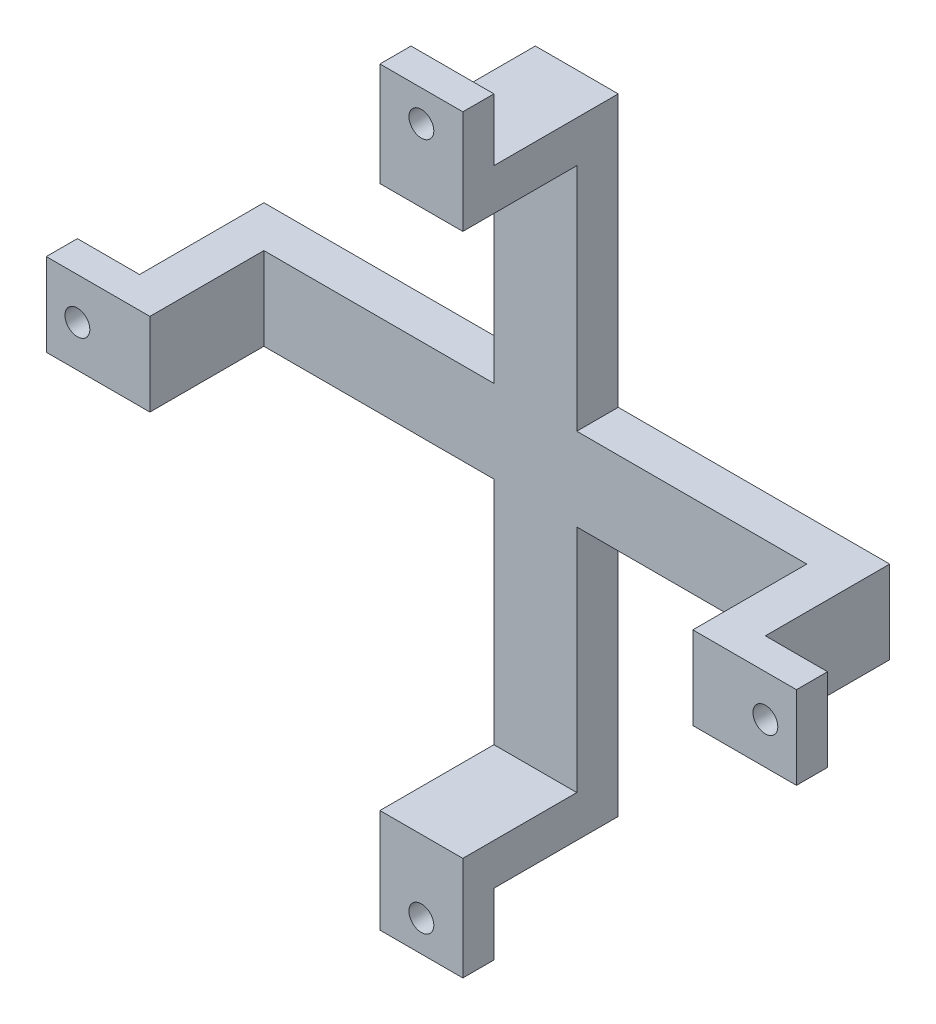
from build123d import *

# Parameters (mm, degrees)
SKETCH_1_W      = 26.2
SKETCH_1_H      = 4
SKETCH_1_W_2    = 4
SKETCH_1_H_2    = 26.2
EXTRUDE_1_DEPTH = 2
SKETCH_1_6_W    = 2
SKETCH_1_6_H    = 4
SKETCH_1_6_W_2  = 4
SKETCH_1_6_H_2  = 2
EXTRUDE_2_DEPTH = 7.5
EXTRUDE_START   = 7.5
SKETCH_1_7_W    = 3
SKETCH_1_7_H    = 4
SKETCH_1_7_R    = 0.6
SKETCH_1_7_W_2  = 4
SKETCH_1_7_H_2  = 3
EXTRUDE_3_DEPTH = 1.5


with BuildPart() as part:
    # 草图1 → 凸台-拉伸1 (new body)
    with BuildSketch(Plane.XY):
        Rectangle(SKETCH_1_W, SKETCH_1_H)
        Rectangle(SKETCH_1_W_2, SKETCH_1_H_2)
    extrude(amount=EXTRUDE_1_DEPTH)

    # 草图1<6> → 凸台-拉伸2 (add)
    with BuildSketch(Plane.XY):
        with Locations((14.1, 0)):
            Rectangle(SKETCH_1_6_W, SKETCH_1_6_H)
        with Locations((0, 14.1)):
            Rectangle(SKETCH_1_6_W_2, SKETCH_1_6_H_2)
        with Locations((0, -14.1)):
            Rectangle(SKETCH_1_6_W_2, SKETCH_1_6_H_2)
        with Locations((-14.1, 0)):
            Rectangle(SKETCH_1_6_W, SKETCH_1_6_H)
    extrude(amount=EXTRUDE_2_DEPTH)

    # 草图1<7> → 凸台-拉伸3 (add)
    # profile 1 of 4: a face of its own
    with BuildSketch(Plane.XY.offset(EXTRUDE_START)):
        with Locations((-16.6, 0)):
            Rectangle(SKETCH_1_7_W, SKETCH_1_7_H)
        with Locations((-16.6, 0)):
            Circle(SKETCH_1_7_R, mode=Mode.SUBTRACT)
    # profile 2 of 4: a face of its own
    with BuildSketch(Plane.XY.offset(EXTRUDE_START)):
        with Locations((0, 16.6)):
            Rectangle(SKETCH_1_7_W_2, SKETCH_1_7_H_2)
        with Locations((0, 16.6)):
            Circle(SKETCH_1_7_R, mode=Mode.SUBTRACT)
    # profile 3 of 4: a face of its own
    with BuildSketch(Plane.XY.offset(EXTRUDE_START)):
        with Locations((16.6, 0)):
            Rectangle(SKETCH_1_7_W, SKETCH_1_7_H)
        with Locations((16.6, 0)):
            Circle(SKETCH_1_7_R, mode=Mode.SUBTRACT)
    # profile 4 of 4: a face of its own
    with BuildSketch(Plane.XY.offset(EXTRUDE_START)):
        with Locations((0, -16.6)):
            Rectangle(SKETCH_1_7_W_2, SKETCH_1_7_H_2)
        with Locations((0, -16.6)):
            Circle(SKETCH_1_7_R, mode=Mode.SUBTRACT)
    extrude(amount=-EXTRUDE_3_DEPTH)


solid = part.part
